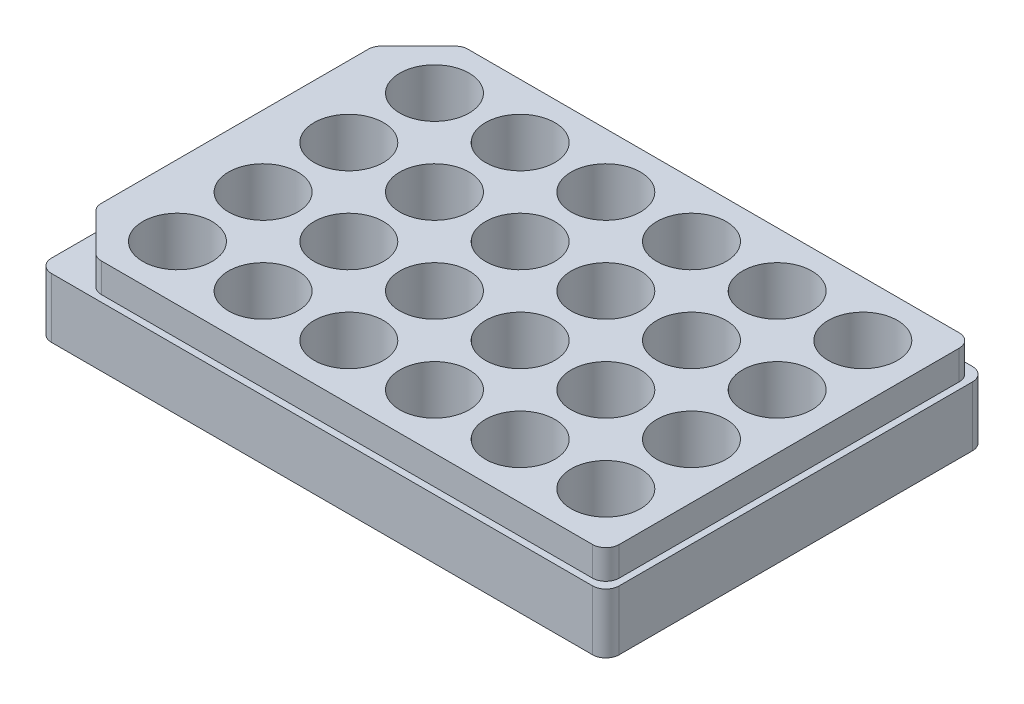
from build123d import *

# Parameters (mm, degrees)
SKETCH1_W                   = 127.89
SKETCH1_H                   = 85.6
MAIN_PLATE_DEPTH            = 20.02
WELLS_LSP_R                 = 7.81
WELLS_DEPTH_DEPTH           = 17.14
SKETCH7_W                   = 127.89
SKETCH7_H                   = 85.6
SKETCH7_W_2                 = 124.89
SKETCH7_H_2                 = 82.6
FLANGE_DEPTH                = 6.57
STYLE_3_DEPTH               = 6.57
THICKNESS_SHELLING_T        = -0.32
ADDT_L_START                = 0.95
WELL_ELEVATOR_R             = 7.81
ADDT_L_WELL_ELEVATION_DEPTH = 0.95
FLANGE_STYLE_FILLETS_R      = 3
PLATE_EDGE_FILLETS_R        = 3


with BuildPart() as part:
    # Sketch1 → Main Plate (new body)
    with BuildSketch(Plane(origin=(0, 0, 0), x_dir=(1, 0, 0), z_dir=(0, 1, 0))):
        Rectangle(SKETCH1_W, SKETCH1_H)
    extrude(amount=MAIN_PLATE_DEPTH)

    # Wells_LSP → Wells Depth (cut)
    with BuildSketch(Plane(origin=(0, 20.02, 0), x_dir=(1, 0, 0), z_dir=(0, 1, 0))):
        with Locations(Location((-46.425, 28.96, 0), (0, 0, 270))):
            Circle(WELLS_LSP_R)
        with Locations(Location((-27.125, 28.96, 0), (0, 0, 270))):
            Circle(WELLS_LSP_R)
        with Locations(Location((-7.825, 28.96, 0), (0, 0, 270))):
            Circle(WELLS_LSP_R)
        with Locations(Location((11.475, 28.96, 0), (0, 0, 270))):
            Circle(WELLS_LSP_R)
        with Locations(Location((30.775, 28.96, 0), (0, 0, 270))):
            Circle(WELLS_LSP_R)
        with Locations(Location((50.075, 28.96, 0), (0, 0, 270))):
            Circle(WELLS_LSP_R)
        with Locations(Location((-27.125, 9.66, 0), (0, 0, 270))):
            Circle(WELLS_LSP_R)
        with Locations(Location((-7.825, 9.66, 0), (0, 0, 270))):
            Circle(WELLS_LSP_R)
        with Locations(Location((11.475, 9.66, 0), (0, 0, 270))):
            Circle(WELLS_LSP_R)
        with Locations(Location((30.775, 9.66, 0), (0, 0, 270))):
            Circle(WELLS_LSP_R)
        with Locations(Location((50.075, 9.66, 0), (0, 0, 270))):
            Circle(WELLS_LSP_R)
        with Locations(Location((-27.125, -9.64, 0), (0, 0, 270))):
            Circle(WELLS_LSP_R)
        with Locations(Location((-7.825, -9.64, 0), (0, 0, 270))):
            Circle(WELLS_LSP_R)
        with Locations(Location((11.475, -9.64, 0), (0, 0, 270))):
            Circle(WELLS_LSP_R)
        with Locations(Location((30.775, -9.64, 0), (0, 0, 270))):
            Circle(WELLS_LSP_R)
        with Locations(Location((50.075, -9.64, 0), (0, 0, 270))):
            Circle(WELLS_LSP_R)
        with Locations(Location((-27.125, -28.94, 0), (0, 0, 270))):
            Circle(WELLS_LSP_R)
        with Locations(Location((-7.825, -28.94, 0), (0, 0, 270))):
            Circle(WELLS_LSP_R)
        with Locations(Location((11.475, -28.94, 0), (0, 0, 270))):
            Circle(WELLS_LSP_R)
        with Locations(Location((30.775, -28.94, 0), (0, 0, 270))):
            Circle(WELLS_LSP_R)
        with Locations(Location((50.075, -28.94, 0), (0, 0, 270))):
            Circle(WELLS_LSP_R)
        with Locations(Location((-46.425, 9.66, 0), (0, 0, 270))):
            Circle(WELLS_LSP_R)
        with Locations(Location((-46.425, -9.64, 0), (0, 0, 270))):
            Circle(WELLS_LSP_R)
        with Locations(Location((-46.425, -28.94, 0), (0, 0, 270))):
            Circle(WELLS_LSP_R)
    extrude(amount=-WELLS_DEPTH_DEPTH, mode=Mode.SUBTRACT)

    # Sketch7 → Flange (cut)
    with BuildSketch(Plane(origin=(0, 20.02, 0), x_dir=(1, 0, 0), z_dir=(0, 1, 0))):
        Rectangle(SKETCH7_W, SKETCH7_H)
        Rectangle(SKETCH7_W_2, SKETCH7_H_2, mode=Mode.SUBTRACT)
    extrude(amount=-FLANGE_DEPTH, mode=Mode.SUBTRACT)

    # Style Sketch → Style <3 (cut)
    with BuildSketch(Plane(origin=(0, 20.02, 0), x_dir=(1, 0, 0), z_dir=(0, 1, 0))):
        Polygon((-62.445, 41.3), (-52.445, 41.3), (-62.445, 31.3), align=None)
        Polygon((-62.445, -41.3), (-52.445, -41.3), (-62.445, -31.3), align=None)
    extrude(amount=-STYLE_3_DEPTH, mode=Mode.SUBTRACT)

    # Thickness Shelling
    thickness_shelling_openings = [part.faces().sort_by_distance(p)[0] for p in [
        (0, 0, 0),
    ]]
    offset(amount=THICKNESS_SHELLING_T, openings=thickness_shelling_openings, kind=Kind.INTERSECTION)

    # Well Elevator → Addt'l Well Elevation (add)
    with BuildSketch(Plane(origin=(0, 2.88, 0), x_dir=(1, 0, 0), z_dir=(0, 1, 0)).offset(ADDT_L_START)):
        with Locations(Location((-46.425, 28.96, 0), (0, 0, 270))):
            Circle(WELL_ELEVATOR_R)
        with Locations(Location((-27.125, 28.96, 0), (0, 0, 270))):
            Circle(WELL_ELEVATOR_R)
        with Locations(Location((-7.825, 28.96, 0), (0, 0, 270))):
            Circle(WELL_ELEVATOR_R)
        with Locations(Location((11.475, 28.96, 0), (0, 0, 270))):
            Circle(WELL_ELEVATOR_R)
        with Locations(Location((30.775, 28.96, 0), (0, 0, 270))):
            Circle(WELL_ELEVATOR_R)
        with Locations(Location((50.075, 28.96, 0), (0, 0, 270))):
            Circle(WELL_ELEVATOR_R)
        with Locations(Location((-27.125, 9.66, 0), (0, 0, 270))):
            Circle(WELL_ELEVATOR_R)
        with Locations(Location((-7.825, 9.66, 0), (0, 0, 270))):
            Circle(WELL_ELEVATOR_R)
        with Locations(Location((11.475, 9.66, 0), (0, 0, 270))):
            Circle(WELL_ELEVATOR_R)
        with Locations(Location((30.775, 9.66, 0), (0, 0, 270))):
            Circle(WELL_ELEVATOR_R)
        with Locations(Location((50.075, 9.66, 0), (0, 0, 270))):
            Circle(WELL_ELEVATOR_R)
        with Locations(Location((-27.125, -9.64, 0), (0, 0, 270))):
            Circle(WELL_ELEVATOR_R)
        with Locations(Location((-7.825, -9.64, 0), (0, 0, 270))):
            Circle(WELL_ELEVATOR_R)
        with Locations(Location((11.475, -9.64, 0), (0, 0, 270))):
            Circle(WELL_ELEVATOR_R)
        with Locations(Location((30.775, -9.64, 0), (0, 0, 270))):
            Circle(WELL_ELEVATOR_R)
        with Locations(Location((50.075, -9.64, 0), (0, 0, 270))):
            Circle(WELL_ELEVATOR_R)
        with Locations(Location((-27.125, -28.94, 0), (0, 0, 270))):
            Circle(WELL_ELEVATOR_R)
        with Locations(Location((-7.825, -28.94, 0), (0, 0, 270))):
            Circle(WELL_ELEVATOR_R)
        with Locations(Location((11.475, -28.94, 0), (0, 0, 270))):
            Circle(WELL_ELEVATOR_R)
        with Locations(Location((30.775, -28.94, 0), (0, 0, 270))):
            Circle(WELL_ELEVATOR_R)
        with Locations(Location((50.075, -28.94, 0), (0, 0, 270))):
            Circle(WELL_ELEVATOR_R)
        with Locations(Location((-46.425, 9.66, 0), (0, 0, 270))):
            Circle(WELL_ELEVATOR_R)
        with Locations(Location((-46.425, -9.64, 0), (0, 0, 270))):
            Circle(WELL_ELEVATOR_R)
        with Locations(Location((-46.425, -28.94, 0), (0, 0, 270))):
            Circle(WELL_ELEVATOR_R)
    extrude(amount=-ADDT_L_WELL_ELEVATION_DEPTH)

    # Flange/Style Fillets
    flange_style_fillets_edges = [part.edges().sort_by_distance(p)[0] for p in [
        (62.445, 16.735, 41.3),
        (62.445, 16.735, -41.3),
        (-62.445, 16.735, -31.3),
        (-52.445, 16.735, -41.3),
        (-62.445, 16.735, 31.3),
        (-52.445, 16.735, 41.3),
        (62.125, 16.415, -40.98),
        (62.125, 16.415, 40.98),
        (-62.125, 16.415, 31.16745166),
        (-52.31245166, 16.415, -40.98),
        (-62.125, 16.415, -31.16745166),
        (-52.31245166, 16.415, 40.98),
    ]]
    fillet(flange_style_fillets_edges, radius=FLANGE_STYLE_FILLETS_R)

    # Plate Edge Fillets
    plate_edge_fillets_edges = [part.edges().sort_by_distance(p)[0] for p in [
        (63.945, 6.725, 42.8),
        (-63.945, 6.725, 42.8),
        (-63.945, 6.725, -42.8),
        (63.945, 6.725, -42.8),
        (-63.625, 6.565, 42.48),
        (-63.625, 6.565, -42.48),
        (63.625, 6.565, -42.48),
        (63.625, 6.565, 42.48),
    ]]
    fillet(plate_edge_fillets_edges, radius=PLATE_EDGE_FILLETS_R)


solid = part.part
